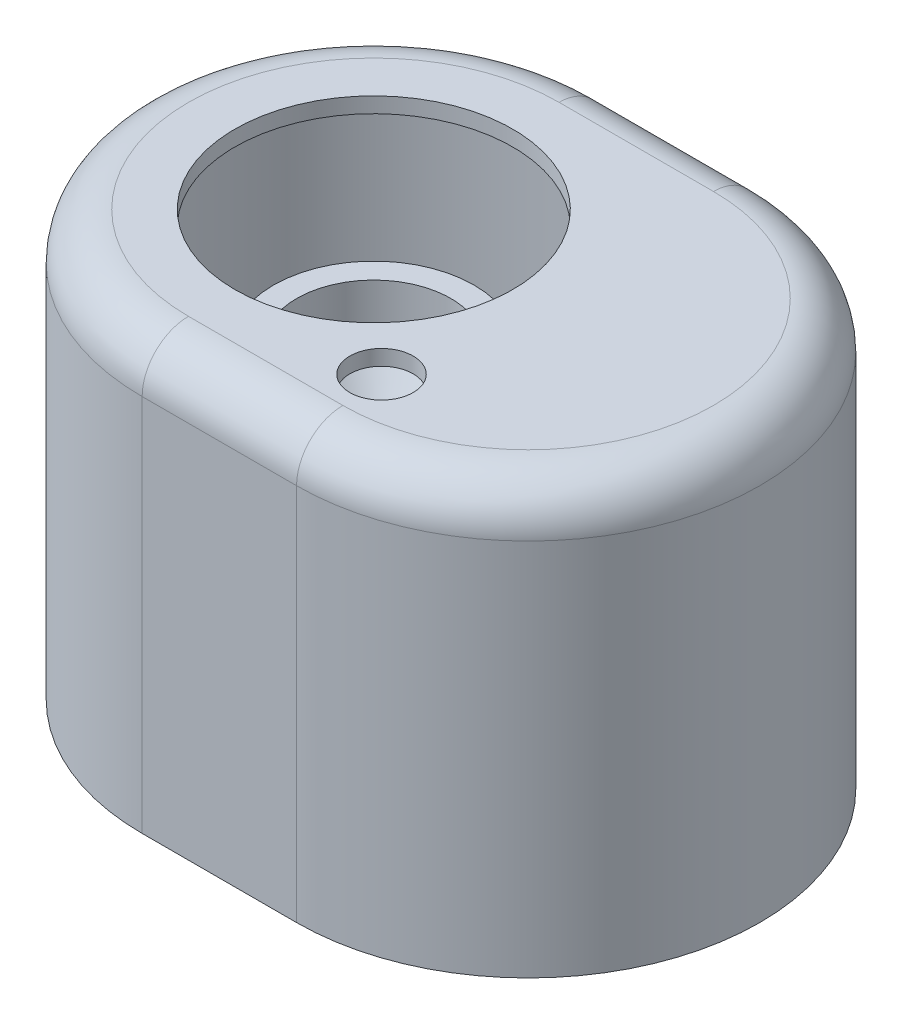
from build123d import *

# Parameters (mm, degrees)
EXTRUDE_1_DEPTH     = 55
FILLET_1_R          = 6
SHELL_3_T           = -2
SKETCH_3_R          = 18
CUT_EXTRUDE_1_DEPTH = 81.156097747
EXTRUDE_2_REACH     = 66.884
SKETCH_7_R          = 4.1
CUT_EXTRUDE_2_DEPTH = 81.156097747
EXTRUDE_START       = -2
EXTRUDE_3_DEPTH     = 4


with BuildPart() as part:
    # 草图2 → 凸台-拉伸1 (new body)
    with BuildSketch(Plane(origin=(0, 0, 0), x_dir=(1, 0, 0), z_dir=(0, 1, 0))):
        with BuildLine():
            Line((0, 30), (20, 30))
            ThreePointArc((20, 30), (50, 0), (20, -30))
            Line((20, -30), (0, -30))
            ThreePointArc((0, -30), (-30, 0), (0, 30))
        make_face()
    extrude(amount=EXTRUDE_1_DEPTH)

    # 圆角1
    fillet_1_edges = [part.edges().sort_by_distance(p)[0] for p in [
        (50, 55, 0),
        (10, 55, -30),
        (-30, 55, 0),
        (10, 55, 30),
    ]]
    fillet(fillet_1_edges, radius=FILLET_1_R)

    # 抽壳3
    shell_3_openings = [part.faces().sort_by_distance(p)[0] for p in [
        (10, 0, 0),
    ]]
    offset(amount=SHELL_3_T, openings=shell_3_openings, kind=Kind.INTERSECTION)

    # 草图3 → 切除-拉伸1 (cut, through all)
    with BuildSketch(Plane(origin=(0, 55, 0), x_dir=(1, 0, 0), z_dir=(0, 1, 0))):
        with Locations(Location((0, 0, 0), (0, 0, 270))):
            Circle(SKETCH_3_R)
    extrude(amount=-CUT_EXTRUDE_1_DEPTH, mode=Mode.SUBTRACT)

    # 草图6 → 凸台-拉伸2 (add, up to next)
    with BuildSketch(Plane(origin=(0, 26.54, 0), x_dir=(-1, 0, 0), z_dir=(0, -1, 0)), mode=Mode.PRIVATE) as extrude_2_sk1:
        with BuildLine():
            ThreePointArc((-27.85, 28.954749179), (-31.070876302, 27.882533922), (-34.15, 26.453307922))
            Line((-34.15, 26.453307922), (-34.15, 19.5))
            ThreePointArc((-34.15, 19.5), (-31, 16.35), (-27.85, 19.5))
            Line((-27.85, 19.5), (-27.85, 28.954749179))
        make_face()
    extrude_2_tool1 = extrude(extrude_2_sk1.sketch, amount=-EXTRUDE_2_REACH, mode=Mode.PRIVATE) - part.part
    # 草图6 → 凸台-拉伸2 (add, up to next)
    with BuildSketch(Plane(origin=(0, 26.54, 0), x_dir=(-1, 0, 0), z_dir=(0, -1, 0)), mode=Mode.PRIVATE) as extrude_2_sk2:
        with BuildLine():
            Line((-27.85, -28.954749179), (-27.85, -19.5))
            ThreePointArc((-27.85, -19.5), (-31, -16.35), (-34.15, -19.5))
            Line((-34.15, -19.5), (-34.15, -26.453307922))
            ThreePointArc((-34.15, -26.453307922), (-31.070876302, -27.882533922), (-27.85, -28.954749179))
        make_face()
    extrude_2_tool2 = extrude(extrude_2_sk2.sketch, amount=-EXTRUDE_2_REACH, mode=Mode.PRIVATE) - part.part
    add(extrude_2_tool1.solids().sort_by_distance((30.878942, 26.54, -22.435225))[0])
    add(extrude_2_tool2.solids().sort_by_distance((30.878942, 26.54, 22.435225))[0])

    # 草图7 → 切除-拉伸2 (cut, through all)
    with BuildSketch(Plane(origin=(0, 55, 0), x_dir=(1, 0, 0), z_dir=(0, 1, 0))):
        with Locations(Location((19, -18, 0), (0, 0, 270))):
            Circle(SKETCH_7_R)
    extrude(amount=-CUT_EXTRUDE_2_DEPTH, mode=Mode.SUBTRACT)

    # 草图8 → 凸台-拉伸3 (add)
    with BuildSketch(Plane.XZ.offset(EXTRUDE_START)):
        with BuildLine():
            Line((20, -28), (0, -28))
            ThreePointArc((0, -28), (-28, 0), (0, 28))
            Line((0, 28), (20, 28))
            ThreePointArc((20, 28), (48, 0), (20, -28))
        make_face()
        with BuildLine():
            ThreePointArc((20, -26.5), (46.5, 0), (20, 26.5))
            Line((20, 26.5), (0, 26.5))
            ThreePointArc((0, 26.5), (-26.5, 0), (0, -26.5))
            Line((0, -26.5), (20, -26.5))
        make_face(mode=Mode.SUBTRACT)
    extrude(amount=-EXTRUDE_3_DEPTH)


with BuildPart() as body_2:
    # 草图5 → 旋转1 (revolve)
    with BuildSketch(Plane.XY, mode=Mode.PRIVATE) as revolve_1_sk:
        Polygon((-10, 40), (-10, 34.437282567), (-8, 34.437282567), (-8, 32.437282567), (-4.5, 27.437282567), (-4.5, 25.437282567), (-6.5, 25.437282567), (-6.5, 21.437282567), (-9.5, 21.437282567), (-9.5, 29), (-13, 34), (-13, 40), align=None)
    revolve(revolve_1_sk.sketch.rotate(Axis((0, 40, 0), (0, -1, 0)), 270), axis=Axis((0, 40, 0), (0, -1, 0)))


solid = Compound([part.part, body_2.part])
